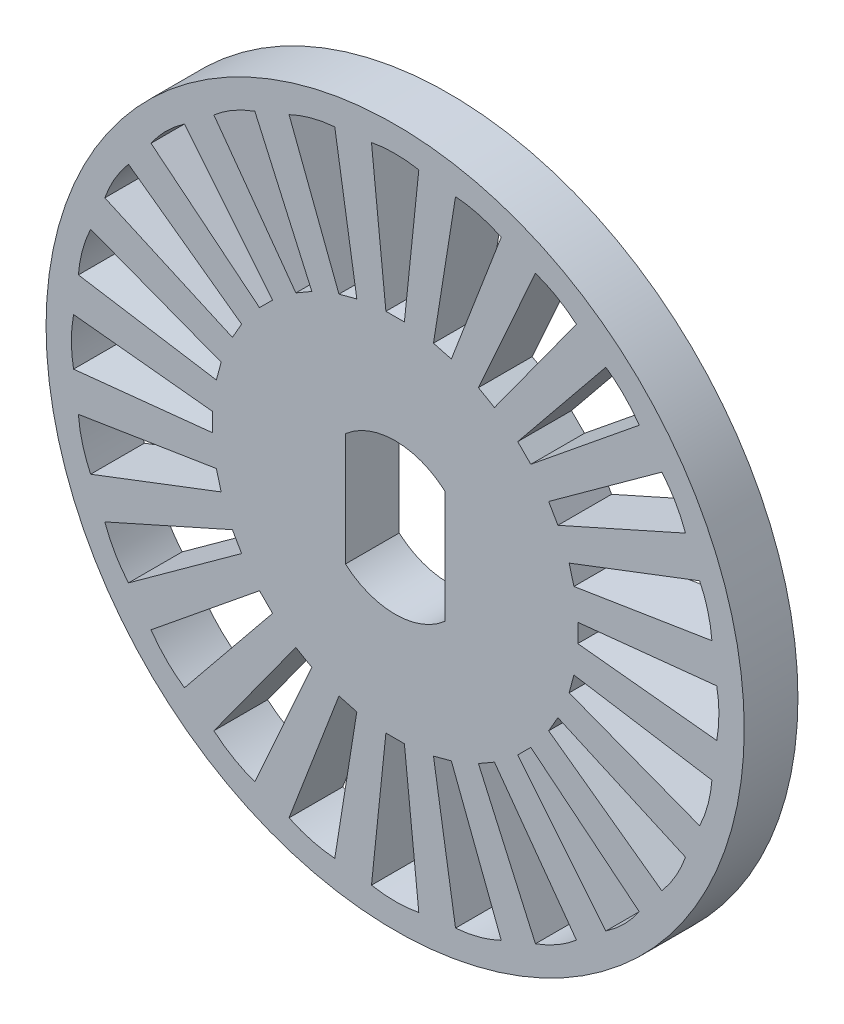
from build123d import *

# Parameters (mm, degrees)
SKETCH1_R           = 13
BOSS_EXTRUDE1_DEPTH = 2
CUT_EXTRUDE1_DEPTH  = 2
CUT_EXTRUDE2_DEPTH  = 2


with BuildPart() as part:
    # Sketch1 → Boss-Extrude1 (new body)
    with BuildSketch(Plane.XY):
        Circle(SKETCH1_R)
    extrude(amount=BOSS_EXTRUDE1_DEPTH)

    # Sketch2 → Cut-Extrude1 (cut)
    with BuildSketch(Plane.XY.offset(2)):
        with BuildLine():
            Line((1.85, 2.101784956), (1.85, -2.101784956))
            ThreePointArc((1.85, -2.101784956), (0, -2.8), (-1.85, -2.101784956))
            Line((-1.85, -2.101784956), (-1.85, 2.101784956))
            ThreePointArc((-1.85, 2.101784956), (0, 2.8), (1.85, 2.101784956))
        make_face()
    extrude(amount=-CUT_EXTRUDE1_DEPTH, mode=Mode.SUBTRACT)

    # Sketch3 → Cut-Extrude2 (cut)
    with BuildSketch(Plane.XY.offset(2)):
        with BuildLine():
            Line((-0.344370627, 6.8), (0.344370627, 6.8))
            Line((0.344370627, 6.8), (0.881305494, 11.975564171))
            add(Edge.make_bspline(
                [(-0.881305494, 11.975564171), (0, 12.13877285), (0.881305494, 11.975564171)],
                knots=[0, 0, 0, 1, 1, 1], degree=2))
            Line((-0.881305494, 11.975564171), (-0.344370627, 6.8))
        make_face()
        with BuildLine():
            Line((2.09260599, 6.479165942), (3.950779821, 11.339408071))
            add(Edge.make_bspline(
                [(2.248228346, 11.795605364), (3.141745598, 11.725154195), (3.950779821, 11.339408071)],
                knots=[0, 0, 0, 1, 1, 1], degree=2))
            Line((2.248228346, 11.795605364), (1.427333024, 6.657425296))
            Line((1.427333024, 6.657425296), (2.09260599, 6.479165942))
        make_face()
        with BuildLine():
            Line((3.698233712, 5.716787432), (6.751015032, 9.93049005))
            add(Edge.make_bspline(
                [(5.224549139, 10.811795544), (6.069386425, 10.512485659), (6.751015032, 9.93049005)],
                knots=[0, 0, 0, 1, 1, 1], degree=2))
            Line((5.224549139, 10.811795544), (3.101766288, 6.061158059))
            Line((3.101766288, 6.061158059), (3.698233712, 5.716787432))
        make_face()
        with BuildLine():
            Line((5.051832918, 4.564819306), (9.091179725, 7.844825543))
            add(Edge.make_bspline(
                [(7.844825543, 9.091179725), (8.583408597, 8.583408597), (9.091179725, 7.844825543)],
                knots=[0, 0, 0, 1, 1, 1], degree=2))
            Line((7.844825543, 9.091179725), (4.564819306, 5.051832918))
            Line((4.564819306, 5.051832918), (5.051832918, 4.564819306))
        make_face()
        with BuildLine():
            Line((6.061158059, 3.101766288), (10.811795544, 5.224549139))
            add(Edge.make_bspline(
                [(9.93049005, 6.751015032), (10.512485659, 6.069386425), (10.811795544, 5.224549139)],
                knots=[0, 0, 0, 1, 1, 1], degree=2))
            Line((9.93049005, 6.751015032), (5.716787432, 3.698233712))
            Line((5.716787432, 3.698233712), (6.061158059, 3.101766288))
        make_face()
        with BuildLine():
            Line((6.657425296, 1.427333024), (11.795605364, 2.248228346))
            add(Edge.make_bspline(
                [(11.339408071, 3.950779821), (11.725154195, 3.141745598), (11.795605364, 2.248228346)],
                knots=[0, 0, 0, 1, 1, 1], degree=2))
            Line((11.339408071, 3.950779821), (6.479165942, 2.09260599))
            Line((6.479165942, 2.09260599), (6.657425296, 1.427333024))
        make_face()
        with BuildLine():
            Line((6.8, -0.344370627), (11.975564171, -0.881305494))
            add(Edge.make_bspline(
                [(11.975564171, 0.881305494), (12.13877285, 0), (11.975564171, -0.881305494)],
                knots=[0, 0, 0, 1, 1, 1], degree=2))
            Line((11.975564171, 0.881305494), (6.8, 0.344370627))
            Line((6.8, 0.344370627), (6.8, -0.344370627))
        make_face()
        with BuildLine():
            Line((6.479165942, -2.09260599), (11.339408071, -3.950779821))
            add(Edge.make_bspline(
                [(11.795605364, -2.248228346), (11.725154195, -3.141745598), (11.339408071, -3.950779821)],
                knots=[0, 0, 0, 1, 1, 1], degree=2))
            Line((11.795605364, -2.248228346), (6.657425296, -1.427333024))
            Line((6.657425296, -1.427333024), (6.479165942, -2.09260599))
        make_face()
        with BuildLine():
            Line((5.716787432, -3.698233712), (9.93049005, -6.751015032))
            add(Edge.make_bspline(
                [(10.811795544, -5.224549139), (10.512485659, -6.069386425), (9.93049005, -6.751015032)],
                knots=[0, 0, 0, 1, 1, 1], degree=2))
            Line((10.811795544, -5.224549139), (6.061158059, -3.101766288))
            Line((6.061158059, -3.101766288), (5.716787432, -3.698233712))
        make_face()
        with BuildLine():
            Line((4.564819306, -5.051832918), (7.844825543, -9.091179725))
            add(Edge.make_bspline(
                [(9.091179725, -7.844825543), (8.583408597, -8.583408597), (7.844825543, -9.091179725)],
                knots=[0, 0, 0, 1, 1, 1], degree=2))
            Line((9.091179725, -7.844825543), (5.051832918, -4.564819306))
            Line((5.051832918, -4.564819306), (4.564819306, -5.051832918))
        make_face()
        with BuildLine():
            Line((3.101766288, -6.061158059), (5.224549139, -10.811795544))
            add(Edge.make_bspline(
                [(6.751015032, -9.93049005), (6.069386425, -10.512485659), (5.224549139, -10.811795544)],
                knots=[0, 0, 0, 1, 1, 1], degree=2))
            Line((6.751015032, -9.93049005), (3.698233712, -5.716787432))
            Line((3.698233712, -5.716787432), (3.101766288, -6.061158059))
        make_face()
        with BuildLine():
            Line((1.427333024, -6.657425296), (2.248228346, -11.795605364))
            add(Edge.make_bspline(
                [(3.950779821, -11.339408071), (3.141745598, -11.725154195), (2.248228346, -11.795605364)],
                knots=[0, 0, 0, 1, 1, 1], degree=2))
            Line((3.950779821, -11.339408071), (2.09260599, -6.479165942))
            Line((2.09260599, -6.479165942), (1.427333024, -6.657425296))
        make_face()
        with BuildLine():
            Line((-0.344370627, -6.8), (-0.881305494, -11.975564171))
            add(Edge.make_bspline(
                [(0.881305494, -11.975564171), (0, -12.13877285), (-0.881305494, -11.975564171)],
                knots=[0, 0, 0, 1, 1, 1], degree=2))
            Line((0.881305494, -11.975564171), (0.344370627, -6.8))
            Line((0.344370627, -6.8), (-0.344370627, -6.8))
        make_face()
        with BuildLine():
            Line((-2.09260599, -6.479165942), (-3.950779821, -11.339408071))
            add(Edge.make_bspline(
                [(-2.248228346, -11.795605364), (-3.141745598, -11.725154195), (-3.950779821, -11.339408071)],
                knots=[0, 0, 0, 1, 1, 1], degree=2))
            Line((-2.248228346, -11.795605364), (-1.427333024, -6.657425296))
            Line((-1.427333024, -6.657425296), (-2.09260599, -6.479165942))
        make_face()
        with BuildLine():
            Line((-3.698233712, -5.716787432), (-6.751015032, -9.93049005))
            add(Edge.make_bspline(
                [(-5.224549139, -10.811795544), (-6.069386425, -10.512485659), (-6.751015032, -9.93049005)],
                knots=[0, 0, 0, 1, 1, 1], degree=2))
            Line((-5.224549139, -10.811795544), (-3.101766288, -6.061158059))
            Line((-3.101766288, -6.061158059), (-3.698233712, -5.716787432))
        make_face()
        with BuildLine():
            Line((-5.051832918, -4.564819306), (-9.091179725, -7.844825543))
            add(Edge.make_bspline(
                [(-7.844825543, -9.091179725), (-8.583408597, -8.583408597), (-9.091179725, -7.844825543)],
                knots=[0, 0, 0, 1, 1, 1], degree=2))
            Line((-7.844825543, -9.091179725), (-4.564819306, -5.051832918))
            Line((-4.564819306, -5.051832918), (-5.051832918, -4.564819306))
        make_face()
        with BuildLine():
            Line((-6.061158059, -3.101766288), (-10.811795544, -5.224549139))
            add(Edge.make_bspline(
                [(-9.93049005, -6.751015032), (-10.512485659, -6.069386425), (-10.811795544, -5.224549139)],
                knots=[0, 0, 0, 1, 1, 1], degree=2))
            Line((-9.93049005, -6.751015032), (-5.716787432, -3.698233712))
            Line((-5.716787432, -3.698233712), (-6.061158059, -3.101766288))
        make_face()
        with BuildLine():
            Line((-6.657425296, -1.427333024), (-11.795605364, -2.248228346))
            add(Edge.make_bspline(
                [(-11.339408071, -3.950779821), (-11.725154195, -3.141745598), (-11.795605364, -2.248228346)],
                knots=[0, 0, 0, 1, 1, 1], degree=2))
            Line((-11.339408071, -3.950779821), (-6.479165942, -2.09260599))
            Line((-6.479165942, -2.09260599), (-6.657425296, -1.427333024))
        make_face()
        with BuildLine():
            Line((-6.8, 0.344370627), (-11.975564171, 0.881305494))
            add(Edge.make_bspline(
                [(-11.975564171, -0.881305494), (-12.13877285, 0), (-11.975564171, 0.881305494)],
                knots=[0, 0, 0, 1, 1, 1], degree=2))
            Line((-11.975564171, -0.881305494), (-6.8, -0.344370627))
            Line((-6.8, -0.344370627), (-6.8, 0.344370627))
        make_face()
        with BuildLine():
            Line((-6.479165942, 2.09260599), (-11.339408071, 3.950779821))
            add(Edge.make_bspline(
                [(-11.795605364, 2.248228346), (-11.725154195, 3.141745598), (-11.339408071, 3.950779821)],
                knots=[0, 0, 0, 1, 1, 1], degree=2))
            Line((-11.795605364, 2.248228346), (-6.657425296, 1.427333024))
            Line((-6.657425296, 1.427333024), (-6.479165942, 2.09260599))
        make_face()
        with BuildLine():
            Line((-5.716787432, 3.698233712), (-9.93049005, 6.751015032))
            add(Edge.make_bspline(
                [(-10.811795544, 5.224549139), (-10.512485659, 6.069386425), (-9.93049005, 6.751015032)],
                knots=[0, 0, 0, 1, 1, 1], degree=2))
            Line((-10.811795544, 5.224549139), (-6.061158059, 3.101766288))
            Line((-6.061158059, 3.101766288), (-5.716787432, 3.698233712))
        make_face()
        with BuildLine():
            Line((-4.564819306, 5.051832918), (-7.844825543, 9.091179725))
            add(Edge.make_bspline(
                [(-9.091179725, 7.844825543), (-8.583408597, 8.583408597), (-7.844825543, 9.091179725)],
                knots=[0, 0, 0, 1, 1, 1], degree=2))
            Line((-9.091179725, 7.844825543), (-5.051832918, 4.564819306))
            Line((-5.051832918, 4.564819306), (-4.564819306, 5.051832918))
        make_face()
        with BuildLine():
            Line((-3.101766288, 6.061158059), (-5.224549139, 10.811795544))
            add(Edge.make_bspline(
                [(-6.751015032, 9.93049005), (-6.069386425, 10.512485659), (-5.224549139, 10.811795544)],
                knots=[0, 0, 0, 1, 1, 1], degree=2))
            Line((-6.751015032, 9.93049005), (-3.698233712, 5.716787432))
            Line((-3.698233712, 5.716787432), (-3.101766288, 6.061158059))
        make_face()
        with BuildLine():
            Line((-1.427333024, 6.657425296), (-2.248228346, 11.795605364))
            add(Edge.make_bspline(
                [(-3.950779821, 11.339408071), (-3.141745598, 11.725154195), (-2.248228346, 11.795605364)],
                knots=[0, 0, 0, 1, 1, 1], degree=2))
            Line((-3.950779821, 11.339408071), (-2.09260599, 6.479165942))
            Line((-2.09260599, 6.479165942), (-1.427333024, 6.657425296))
        make_face()
    extrude(amount=-CUT_EXTRUDE2_DEPTH, mode=Mode.SUBTRACT)


solid = part.part
